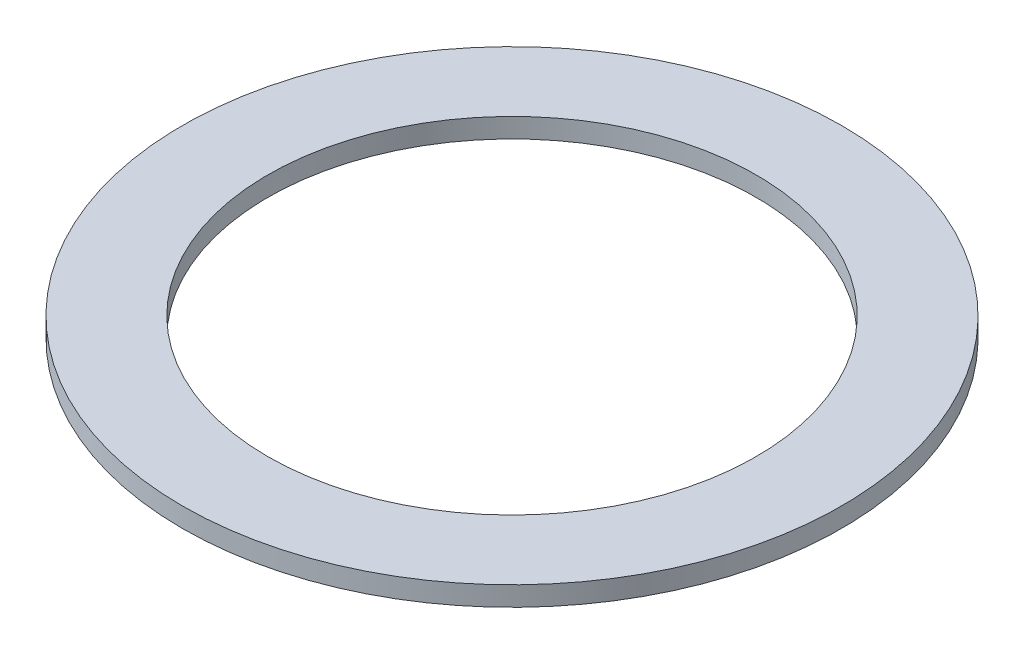
from build123d import *

# Parameters (mm, degrees)
SKETCH1_R           = 67.5
SKETCH1_R_2         = 50
BOSS_EXTRUDE1_DEPTH = 4


with BuildPart() as part:
    # Sketch1 → Boss-Extrude1 (new body)
    with BuildSketch(Plane(origin=(0, 0, 0), x_dir=(1, 0, 0), z_dir=(0, 1, 0))):
        with Locations(Location((0, 0, 0), (0, 0, 270))):
            Circle(SKETCH1_R)
        with Locations(Location((0, 0, 0), (0, 0, 270))):
            Circle(SKETCH1_R_2, mode=Mode.SUBTRACT)
    extrude(amount=BOSS_EXTRUDE1_DEPTH)


solid = part.part
